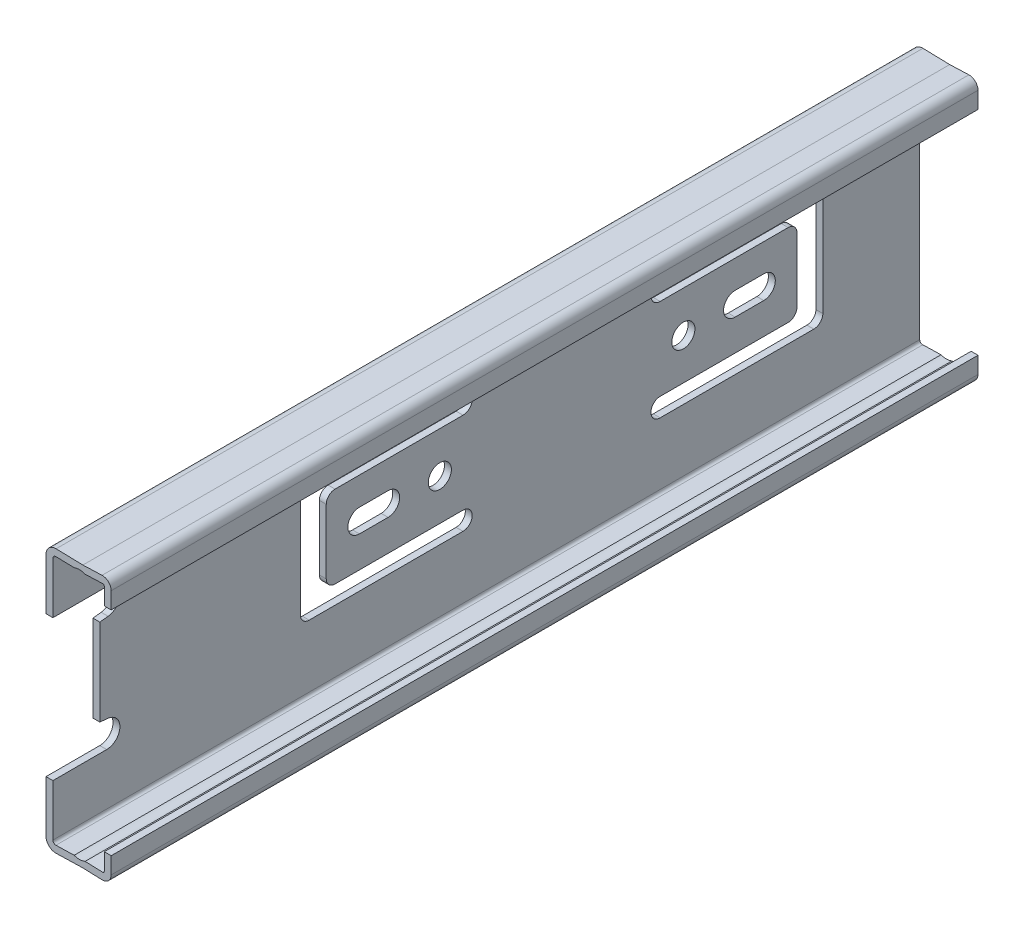
from build123d import *

# Parameters (mm, degrees)
BOSS_EXTRUDE1_DEPTH     = 150
CUT_EXTRUDE5_DEPTH      = 153.060765161
CUT_EXTRUDE6_DEPTH      = 153.060765161
CUT_EXTRUDE6_DEPTH_BACK = 153.060765161
SKETCH3_R               = 2
CUT_EXTRUDE7_DEPTH      = 153.060765161
CUT_EXTRUDE7_DEPTH_BACK = 153.060765161
SKETCH6_R               = 2


with BuildPart() as part:
    # Sketch1 → Boss-Extrude1 (new body)
    with BuildSketch(Plane.XY):
        with BuildLine():
            Line((4.445, 18.415), (5.6388, 18.415))
            Line((5.6388, 18.415), (5.6388, 21.294464083))
            ThreePointArc((5.6388, 21.294464083), (5.173007463, 22.391174147), (4.060357789, 22.817491346))
            Line((4.060357789, 22.817491346), (0.743323143, 22.698920454))
            Line((0.743323143, 22.698920454), (-3.892452069, 22.8203125))
            ThreePointArc((-3.892452069, 22.8203125), (-5.124499805, 22.338098312), (-5.6388, 21.119095664))
            Line((-5.6388, 21.119095664), (-5.6388, -21.119095664))
            ThreePointArc((-5.6388, -21.119095664), (-5.124499805, -22.338098312), (-3.892452069, -22.8203125))
            Line((-3.892452069, -22.8203125), (0.743323143, -22.698920454))
            Line((0.743323143, -22.698920454), (4.060357789, -22.817491346))
            ThreePointArc((4.060357789, -22.817491346), (5.173007463, -22.391174147), (5.6388, -21.294464083))
            Line((5.6388, -21.294464083), (5.6388, -18.415))
            Line((5.6388, -18.415), (4.445, -18.415))
            Line((4.445, -18.415), (4.445, -21.3734366))
            ThreePointArc((4.445, -21.3734366), (4.367367911, -21.55622161), (4.181926298, -21.627274477))
            Line((4.181926298, -21.627274477), (1.131158407, -21.51822157))
            ThreePointArc((1.131158407, -21.51822157), (0.187154328, -21.71413397), (-0.761857041, -21.544125758))
            Line((-0.761857041, -21.544125758), (-3.92370211, -21.626921585))
            ThreePointArc((-3.92370211, -21.626921585), (-4.291477554, -21.482977052), (-4.445, -21.119095664))
            Line((-4.445, -21.119095664), (-4.445, 21.119095664))
            ThreePointArc((-4.445, 21.119095664), (-4.291477554, 21.482977052), (-3.92370211, 21.626921585))
            Line((-3.92370211, 21.626921585), (-0.761857041, 21.544125758))
            ThreePointArc((-0.761857041, 21.544125758), (0.187154328, 21.71413397), (1.131158407, 21.51822157))
            Line((1.131158407, 21.51822157), (4.191, 21.6274366))
            ThreePointArc((4.191, 21.6274366), (4.370605122, 21.553041722), (4.445, 21.3734366))
            Line((4.445, 21.3734366), (4.445, 18.415))
        make_face()
    extrude(amount=BOSS_EXTRUDE1_DEPTH)

    # Sketch2 → Cut-Extrude5 (cut, through all)
    with BuildSketch(Plane(origin=(-4.445, 0, 0), x_dir=(0, 0, -1), z_dir=(1, 0, 0))):
        with BuildLine():
            Line((-150.086983229, 12.208813289), (-150.086983229, -12.200691478))
            Line((-150.086983229, -12.200691478), (-140.690340072, -12.200691478))
            ThreePointArc((-140.690340072, -12.200691478), (-138.407548952, -10.035772864), (-140.448517226, -7.641517989))
            Line((-140.448517226, -7.641517989), (-141.882783229, -7.4889391))
            Line((-141.882783229, -7.4889391), (-141.882783229, 7.497060911))
            Line((-141.882783229, 7.497060911), (-140.448517226, 7.6496398))
            ThreePointArc((-140.448517226, 7.6496398), (-138.407548952, 10.043894675), (-140.690340072, 12.208813289))
            Line((-140.690340072, 12.208813289), (-150.086983229, 12.208813289))
        make_face()
    extrude(amount=-CUT_EXTRUDE5_DEPTH, mode=Mode.SUBTRACT)

    # Sketch3 → Cut-Extrude6 (cut, two sides: drawn at the far end of the back side and taken through both)
    with BuildSketch(Plane(origin=(-4.445, 0, 0), x_dir=(0, 0, -1), z_dir=(1, 0, 0)).offset(-CUT_EXTRUDE6_DEPTH_BACK)):
        with Locations(Location((-83.046273188, -0.038624064, 0), (0, 0, 90))):
            Circle(SKETCH3_R)
        with BuildLine():
            Line((-105.612723982, 10.28792521), (-79.030103641, 10.28792521))
            ThreePointArc((-79.030103641, 10.28792521), (-77.422829038, 8.680650607), (-79.030103641, 7.073376004))
            Line((-79.030103641, 7.073376004), (-101.174207902, 7.073376004))
            ThreePointArc((-101.174207902, 7.073376004), (-102.251838636, 6.627006739), (-102.698207902, 5.549376004))
            Line((-102.698207902, 5.549376004), (-102.698207902, -5.626624133))
            ThreePointArc((-102.698207902, -5.626624133), (-102.251199404, -6.70579811), (-101.172025428, -7.152806607))
            Line((-101.172025428, -7.152806607), (-79.030103641, -7.152806607))
            ThreePointArc((-79.030103641, -7.152806607), (-77.443694877, -8.73921537), (-79.030103641, -10.325624133))
            Line((-79.030103641, -10.325624133), (-105.652273188, -10.325624133))
            ThreePointArc((-105.652273188, -10.325624133), (-106.729903922, -9.879254868), (-107.176273188, -8.801624133))
            Line((-107.176273188, -8.801624133), (-107.176273188, 8.724376004))
            ThreePointArc((-107.176273188, 8.724376004), (-106.718320228, 9.82997225), (-105.612723982, 10.28792521))
        make_face()
        with BuildLine():
            Line((-96.952773188, 2.247375936), (-91.999773188, 2.247375936))
            ThreePointArc((-91.999773188, 2.247375936), (-89.999773188, 0.247375936), (-91.999773188, -1.752624064))
            Line((-91.999773188, -1.752624064), (-96.952773188, -1.752624064))
            ThreePointArc((-96.952773188, -1.752624064), (-98.952773188, 0.247375936), (-96.952773188, 2.247375936))
        make_face()
    extrude(amount=CUT_EXTRUDE6_DEPTH + CUT_EXTRUDE6_DEPTH_BACK, mode=Mode.SUBTRACT)

    # Sketch6 → Cut-Extrude7 (cut, two sides: drawn at the far end of the back side and taken through both)
    with BuildSketch(Plane(origin=(-4.445, 0, 0), x_dir=(0, 0, -1), z_dir=(1, 0, 0)).offset(-CUT_EXTRUDE7_DEPTH_BACK)):
        with Locations(Location((-40.899819498, -0.049300509, 0), (0, 0, 90))):
            Circle(SKETCH6_R)
        with BuildLine():
            Line((-18.333368704, -10.375849783), (-44.915989045, -10.375849783))
            ThreePointArc((-44.915989045, -10.375849783), (-46.523263648, -8.76857518), (-44.915989045, -7.161300577))
            Line((-44.915989045, -7.161300577), (-22.771884784, -7.161300577))
            ThreePointArc((-22.771884784, -7.161300577), (-21.694254049, -6.714931312), (-21.247884784, -5.637300577))
            Line((-21.247884784, -5.637300577), (-21.247884784, 5.53869956))
            ThreePointArc((-21.247884784, 5.53869956), (-21.694893281, 6.617873536), (-22.774067257, 7.064882034))
            Line((-22.774067257, 7.064882034), (-44.915989045, 7.064882034))
            ThreePointArc((-44.915989045, 7.064882034), (-46.502397808, 8.651290797), (-44.915989045, 10.23769956))
            Line((-44.915989045, 10.23769956), (-18.293819498, 10.23769956))
            ThreePointArc((-18.293819498, 10.23769956), (-17.216188763, 9.791330295), (-16.769819498, 8.71369956))
            Line((-16.769819498, 8.71369956), (-16.769819498, -8.812300577))
            ThreePointArc((-16.769819498, -8.812300577), (-17.227772458, -9.917896824), (-18.333368704, -10.375849783))
        make_face()
        with BuildLine():
            Line((-26.993319498, -1.763300509), (-31.946319498, -1.763300509))
            ThreePointArc((-31.946319498, -1.763300509), (-33.946319498, 0.236699491), (-31.946319498, 2.236699491))
            Line((-31.946319498, 2.236699491), (-26.993319498, 2.236699491))
            ThreePointArc((-26.993319498, 2.236699491), (-24.993319498, 0.236699491), (-26.993319498, -1.763300509))
        make_face()
    extrude(amount=CUT_EXTRUDE7_DEPTH + CUT_EXTRUDE7_DEPTH_BACK, mode=Mode.SUBTRACT)


solid = part.part
